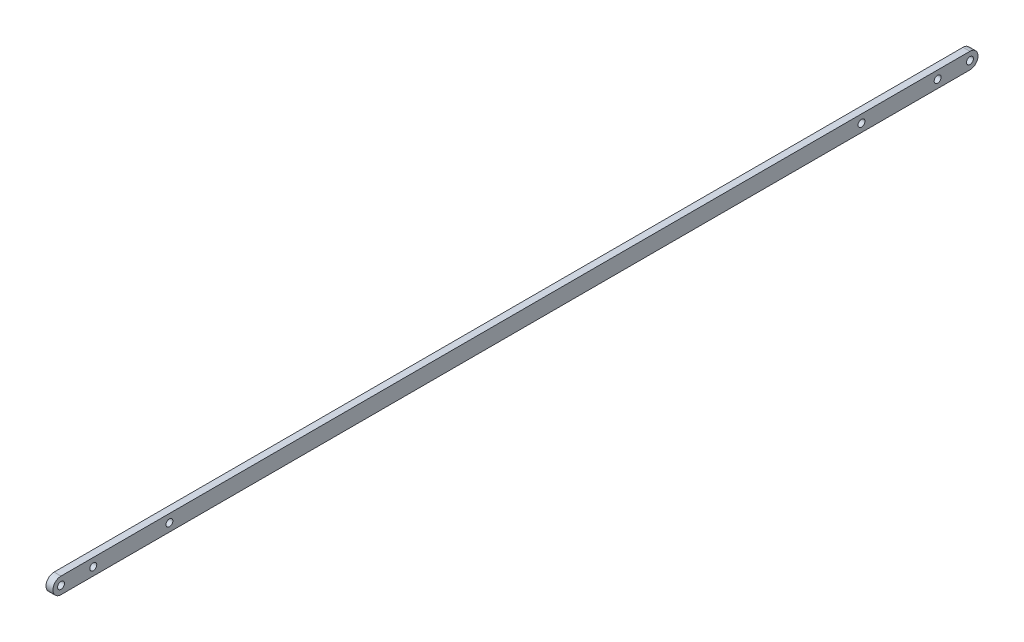
from build123d import *

# Parameters (mm, degrees)
SKETCH_1_R      = 1.5
EXTRUDE_1_DEPTH = 3


with BuildPart() as part:
    # 草图1 → 凸台-拉伸1 (new body)
    with BuildSketch(Plane(origin=(0, 0, 0), x_dir=(0, 0, -1), z_dir=(1, 0, 0))):
        with BuildLine():
            Line((0, 5), (394, 5))
            ThreePointArc((394, 5), (397.5, 1.5), (394, -2))
            Line((394, -2), (0, -2))
            ThreePointArc((0, -2), (-3.5, 1.5), (0, 5))
        make_face()
        with Locations((14, 1.5)):
            Circle(SKETCH_1_R, mode=Mode.SUBTRACT)
        with Locations((380, 1.5)):
            Circle(SKETCH_1_R, mode=Mode.SUBTRACT)
        with Locations((47, 1.5)):
            Circle(SKETCH_1_R, mode=Mode.SUBTRACT)
        with Locations((347, 1.5)):
            Circle(SKETCH_1_R, mode=Mode.SUBTRACT)
        with BuildLine():
            ThreePointArc((0, 3), (-1.5, 1.5), (0, 0))
            ThreePointArc((0, 0), (1.5, 1.5), (0, 3))
        make_face(mode=Mode.SUBTRACT)
        with BuildLine():
            ThreePointArc((394, 3), (395.5, 1.5), (394, 0))
            ThreePointArc((394, 0), (392.5, 1.5), (394, 3))
        make_face(mode=Mode.SUBTRACT)
    extrude(amount=EXTRUDE_1_DEPTH)


solid = part.part
